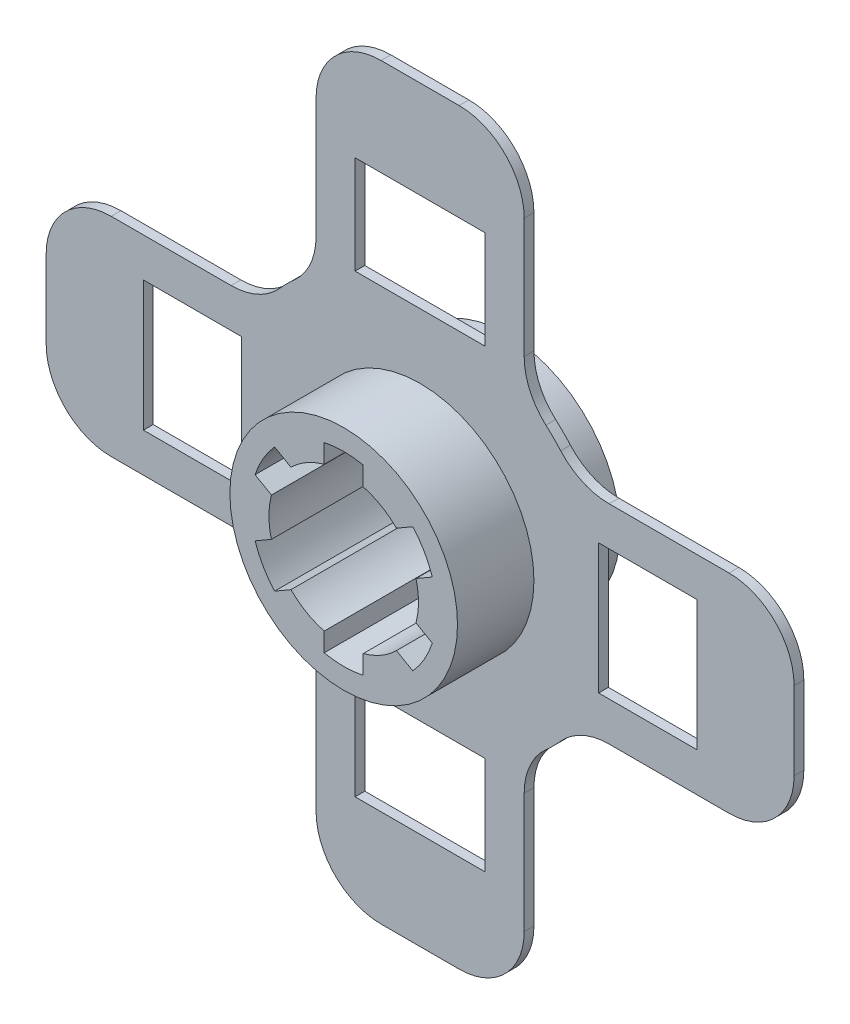
from build123d import *

# Parameters (mm, degrees)
SKETCH1_W           = 20
SKETCH1_H           = 15.1
SKETCH1_W_2         = 15.1
SKETCH1_H_2         = 20
SKETCH1_R           = 17.5
BOSS_EXTRUDE1_DEPTH = 0.75
SKETCH1_3_R         = 17.5
BOSS_EXTRUDE2_DEPTH = 12.5


with BuildPart() as part:
    # Sketch1 → Boss-Extrude1 (new, symmetric)
    with BuildSketch(Plane.XY):
        with BuildLine():
            ThreePointArc((-16, -47.5), (-13.071067812, -54.571067812), (-6, -57.5))
            Line((-6, -57.5), (6, -57.5))
            ThreePointArc((6, -57.5), (13.071067812, -54.571067812), (16, -47.5))
            Line((16, -47.5), (16, -29.068883707))
            ThreePointArc((16, -29.068883707), (16.871290708, -24.986400803), (19.333333333, -21.615323782))
            ThreePointArc((19.333333333, -21.615323782), (20.506096654, -20.506096654), (21.615323782, -19.333333333))
            ThreePointArc((21.615323782, -19.333333333), (24.986400803, -16.871290708), (29.068883707, -16))
            Line((29.068883707, -16), (47.5, -16))
            ThreePointArc((47.5, -16), (54.571067812, -13.071067812), (57.5, -6))
            Line((57.5, -6), (57.5, 6))
            ThreePointArc((57.5, 6), (54.571067812, 13.071067812), (47.5, 16))
            Line((47.5, 16), (29.068883707, 16))
            ThreePointArc((29.068883707, 16), (24.986400803, 16.871290708), (21.615323782, 19.333333333))
            ThreePointArc((21.615323782, 19.333333333), (20.506096654, 20.506096654), (19.333333333, 21.615323782))
            ThreePointArc((19.333333333, 21.615323782), (16.871290708, 24.986400803), (16, 29.068883707))
            Line((16, 29.068883707), (16, 47.5))
            ThreePointArc((16, 47.5), (13.071067812, 54.571067812), (6, 57.5))
            Line((6, 57.5), (-6, 57.5))
            ThreePointArc((-6, 57.5), (-13.071067812, 54.571067812), (-16, 47.5))
            Line((-16, 47.5), (-16, 29.068883707))
            ThreePointArc((-16, 29.068883707), (-16.871290708, 24.986400803), (-19.333333333, 21.615323782))
            ThreePointArc((-19.333333333, 21.615323782), (-20.506096654, 20.506096654), (-21.615323782, 19.333333333))
            ThreePointArc((-21.615323782, 19.333333333), (-24.986400803, 16.871290708), (-29.068883707, 16))
            Line((-29.068883707, 16), (-47.5, 16))
            ThreePointArc((-47.5, 16), (-54.571067812, 13.071067812), (-57.5, 6))
            Line((-57.5, 6), (-57.5, -6))
            ThreePointArc((-57.5, -6), (-54.571067812, -13.071067812), (-47.5, -16))
            Line((-47.5, -16), (-29.068883707, -16))
            ThreePointArc((-29.068883707, -16), (-24.986400803, -16.871290708), (-21.615323782, -19.333333333))
            ThreePointArc((-21.615323782, -19.333333333), (-20.506096654, -20.506096654), (-19.333333333, -21.615323782))
            ThreePointArc((-19.333333333, -21.615323782), (-16.871290708, -24.986400803), (-16, -29.068883707))
            Line((-16, -29.068883707), (-16, -47.5))
        make_face()
        with Locations((0, -35)):
            Rectangle(SKETCH1_W, SKETCH1_H, mode=Mode.SUBTRACT)
        with Locations((-35, 0)):
            Rectangle(SKETCH1_W_2, SKETCH1_H_2, mode=Mode.SUBTRACT)
        Circle(SKETCH1_R, mode=Mode.SUBTRACT)
        with Locations((0, 35)):
            Rectangle(SKETCH1_W, SKETCH1_H, mode=Mode.SUBTRACT)
        with Locations((35, 0)):
            Rectangle(SKETCH1_W_2, SKETCH1_H_2, mode=Mode.SUBTRACT)
    extrude(amount=BOSS_EXTRUDE1_DEPTH, both=True)

    # Sketch1<3> → Boss-Extrude2 (add, symmetric)
    with BuildSketch(Plane.XY):
        Circle(SKETCH1_3_R)
        with BuildLine():
            ThreePointArc((-8.114442262, 8.148977039), (-5.75, 9.959292144), (-3, 11.101801656))
            Line((-3, 11.101801656), (-3, 14))
            ThreePointArc((-3, 14), (0, 14.317821063), (3, 14))
            Line((3, 14), (3, 11.101801656))
            ThreePointArc((3, 11.101801656), (5.75, 9.959292144), (8.114442262, 8.148977039))
            Line((8.114442262, 8.148977039), (10.624355653, 9.598076211))
            ThreePointArc((10.624355653, 9.598076211), (12.399596768, 7.158910532), (13.624355653, 4.401923789))
            Line((13.624355653, 4.401923789), (11.114442262, 2.952824616))
            ThreePointArc((11.114442262, 2.952824616), (11.5, 0), (11.114442262, -2.952824616))
            Line((11.114442262, -2.952824616), (13.624355653, -4.401923789))
            ThreePointArc((13.624355653, -4.401923789), (12.399596768, -7.158910532), (10.624355653, -9.598076211))
            Line((10.624355653, -9.598076211), (8.114442262, -8.148977039))
            ThreePointArc((8.114442262, -8.148977039), (5.75, -9.959292144), (3, -11.101801656))
            Line((3, -11.101801656), (3, -14))
            ThreePointArc((3, -14), (0, -14.317821063), (-3, -14))
            Line((-3, -14), (-3, -11.101801656))
            ThreePointArc((-3, -11.101801656), (-5.75, -9.959292144), (-8.114442262, -8.148977039))
            Line((-8.114442262, -8.148977039), (-10.624355653, -9.598076211))
            ThreePointArc((-10.624355653, -9.598076211), (-12.399596768, -7.158910532), (-13.624355653, -4.401923789))
            Line((-13.624355653, -4.401923789), (-11.114442262, -2.952824616))
            ThreePointArc((-11.114442262, -2.952824616), (-11.5, 0), (-11.114442262, 2.952824616))
            Line((-11.114442262, 2.952824616), (-13.624355653, 4.401923789))
            ThreePointArc((-13.624355653, 4.401923789), (-12.399596768, 7.158910532), (-10.624355653, 9.598076211))
            Line((-10.624355653, 9.598076211), (-8.114442262, 8.148977039))
        make_face(mode=Mode.SUBTRACT)
    extrude(amount=BOSS_EXTRUDE2_DEPTH, both=True)


solid = part.part
